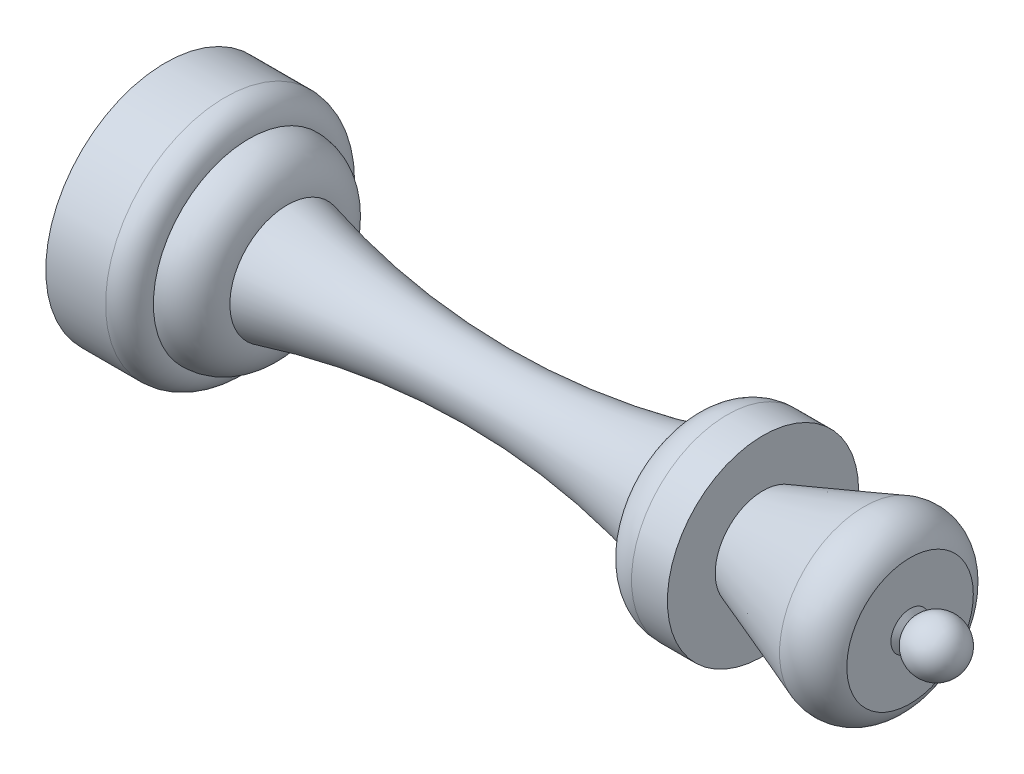
from build123d import *


with BuildPart() as part:
    # Sketch 153 → Повернуть1 (revolve)
    with BuildSketch(Plane(origin=(0, 0, 0), x_dir=(1, 0, 0), z_dir=(0, 1, 0))):
        Polygon((0, 10), (0, 0), (1, 0), (1, 5.25), (3.5, 5.25), (3.5, 0), (5, 0), (5, 10), align=None)
        with BuildLine():
            ThreePointArc((7, 8), (6.414213562, 9.414213562), (5, 10))
            Line((5, 10), (5, 0))
            Line((5, 0), (7, 0))
            Line((7, 0), (7, 8))
        make_face()
        with BuildLine():
            ThreePointArc((10.2, 4.8), (9.2627417, 7.0627417), (7, 8))
            Line((7, 8), (7, 0))
            Line((7, 0), (10.2, 0))
            Line((10.2, 0), (10.2, 4.8))
        make_face()
    revolve(axis=Axis((5, 0, 0), (-1, 0, 0)))

    # Sketch 881 → Повернуть2 (revolve)
    with BuildSketch(Plane(origin=(0, 0, 0), x_dir=(1, 0, 0), z_dir=(0, 1, 0))):
        with BuildLine():
            Line((10.2, 4.8), (10.2, 0))
            Line((10.2, 0), (66.7, 0))
            ThreePointArc((66.7, 0), (65.069401899, 2.125036818), (62.594744112, 1.1))
            Line((62.594744112, 1.1), (62.3, 1.6))
            Line((62.3, 1.6), (62.3, 5.291657255))
            ThreePointArc((62.3, 5.291657255), (60.748015293, 6.979485771), (58.457233587, 7.07818129))
            Line((58.457233587, 7.07818129), (50, 4))
            Line((50, 4), (50, 8))
            Line((50, 8), (47, 8))
            ThreePointArc((47, 8), (44.7372583, 7.0627417), (43.8, 4.8))
            ThreePointArc((43.8, 4.8), (27, 2.591400685), (10.2, 4.8))
        make_face()
    revolve(axis=Axis((50, 0, 0), (-1, 0, 0)))


solid = part.part
